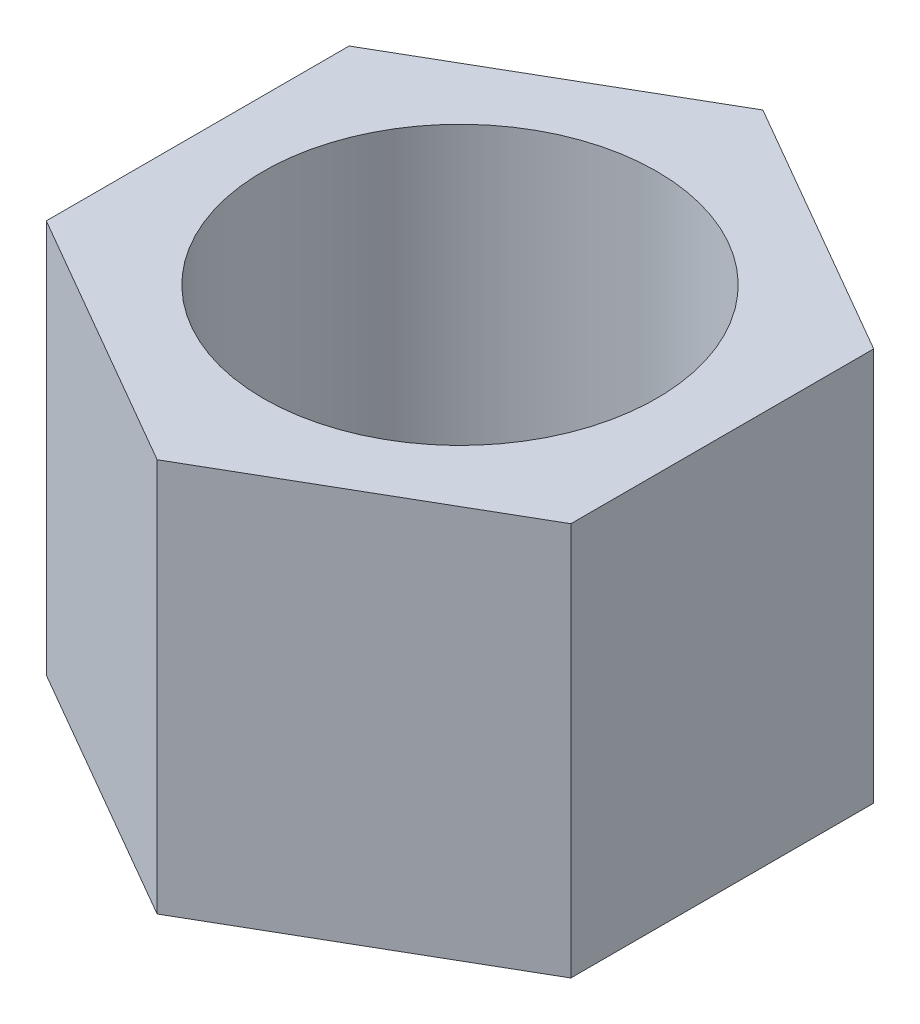
from build123d import *

# Parameters (mm, degrees)
SKETCH_1_R      = 1.5
EXTRUDE_1_DEPTH = 3


with BuildPart() as part:
    # 草图1 → 凸台-拉伸1 (new body)
    with BuildSketch(Plane(origin=(0, 0, 0), x_dir=(1, 0, 0), z_dir=(0, 1, 0))):
        Polygon((0, 2.309401077), (-2, 1.154700538), (-2, -1.154700538), (0, -2.309401077), (2, -1.154700538), (2, 1.154700538), align=None)
        with Locations(Location((0, 0, 0), (0, 0, 270))):
            Circle(SKETCH_1_R, mode=Mode.SUBTRACT)
    extrude(amount=EXTRUDE_1_DEPTH)


solid = part.part
